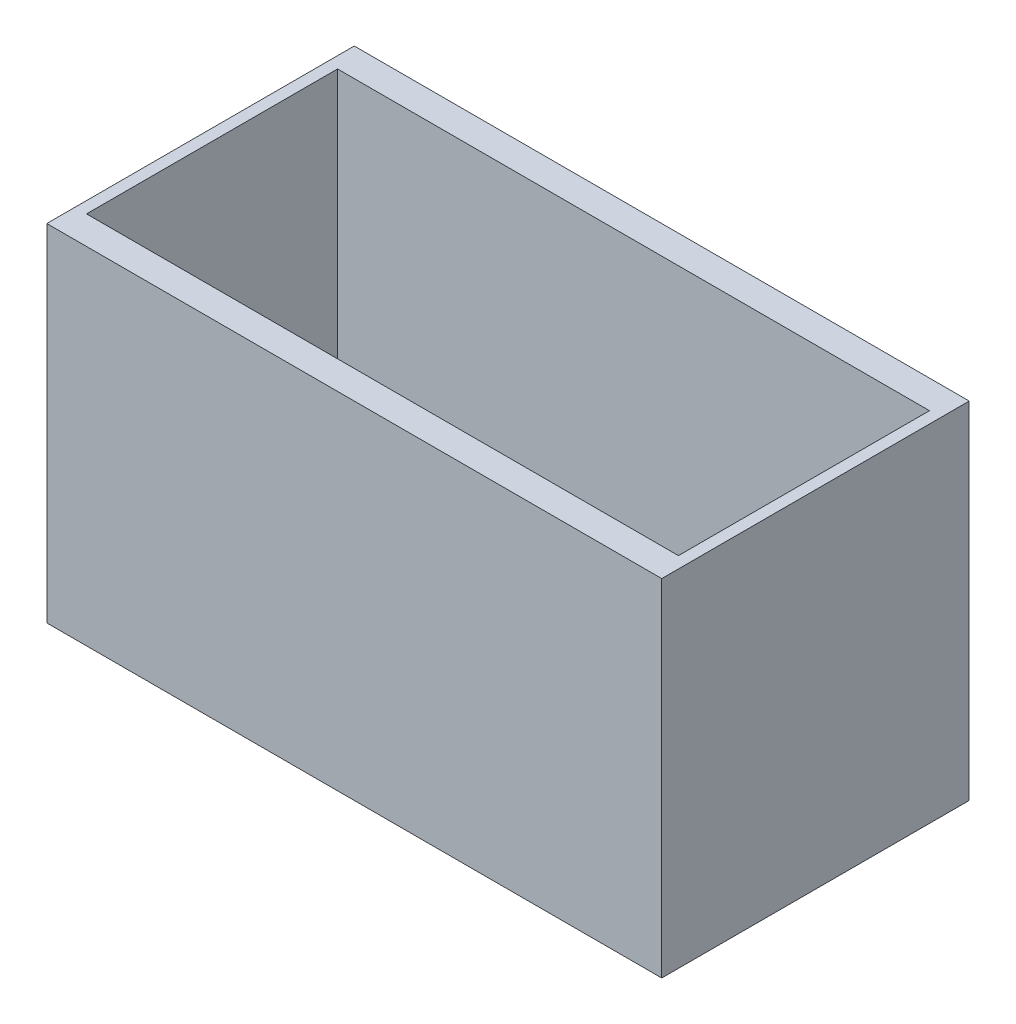
from build123d import *

# Parameters (mm, degrees)
SKETCH1_W           = 80
SKETCH1_H           = 40
BOSS_EXTRUDE1_DEPTH = 45
SKETCH2_W           = 77
SKETCH2_H           = 32.657294734
CUT_EXTRUDE1_DEPTH  = 44


with BuildPart() as part:
    # Sketch1 → Boss-Extrude1 (new body)
    with BuildSketch(Plane(origin=(0, 0, 0), x_dir=(1, 0, 0), z_dir=(0, 1, 0))):
        Rectangle(SKETCH1_W, SKETCH1_H)
    extrude(amount=BOSS_EXTRUDE1_DEPTH)

    # Sketch2 → Cut-Extrude1 (cut)
    with BuildSketch(Plane(origin=(0, 45, 0), x_dir=(1, 0, 0), z_dir=(0, 1, 0))):
        Rectangle(SKETCH2_W, SKETCH2_H)
    extrude(amount=-CUT_EXTRUDE1_DEPTH, mode=Mode.SUBTRACT)


solid = part.part
